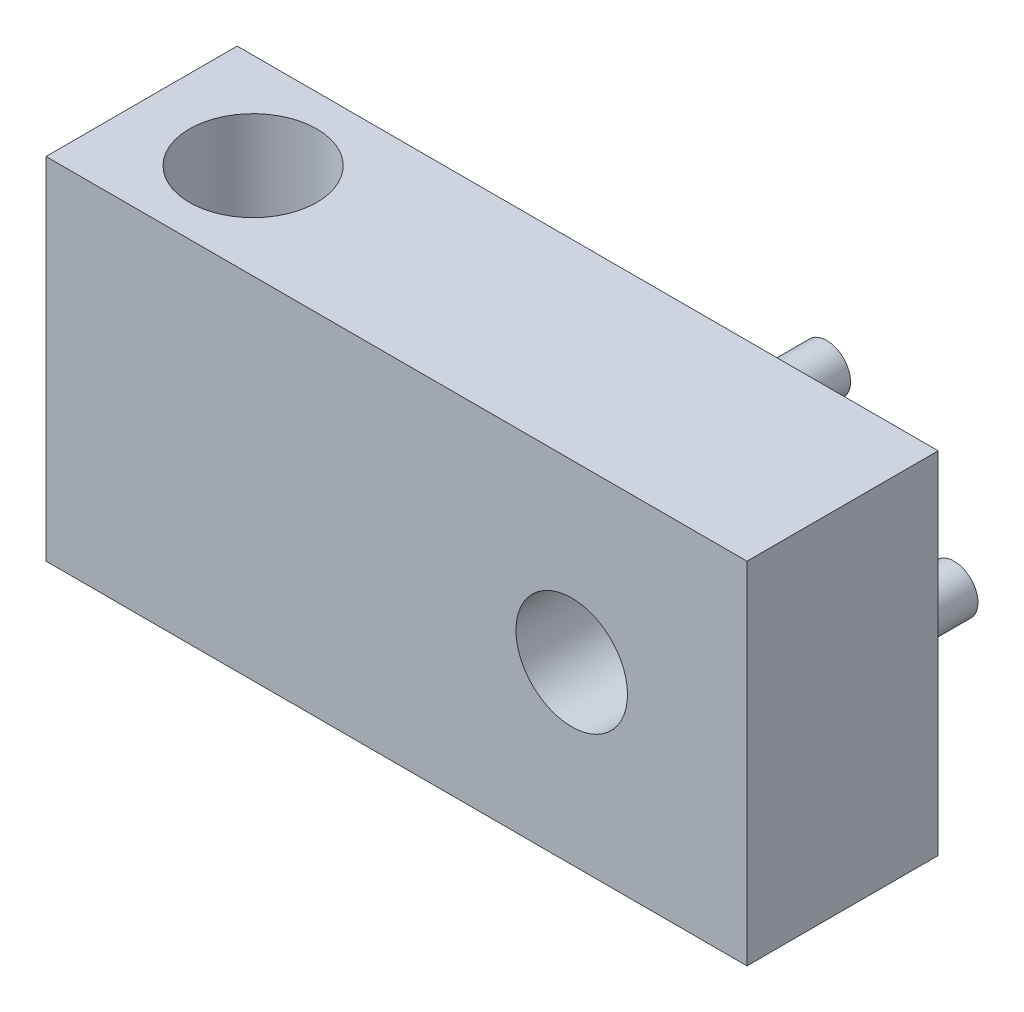
from build123d import *

# Parameters (mm, degrees)
SKETCH_1_W          = 22
SKETCH_1_H          = 22
EXTRUDE_1_DEPTH     = 12
SKETCH_3_R          = 3.5
CUT_EXTRUDE_2_DEPTH = 12
SKETCH_5_R          = 1.5
EXTRUDE_2_DEPTH     = 4
SKETCH_6_W          = 12
SKETCH_6_H          = 22
EXTRUDE_3_DEPTH     = 22
SKETCH_7_R          = 4
CUT_EXTRUDE_3_DEPTH = 22


with BuildPart() as part:
    # 草图1 → 凸台-拉伸1 (new body)
    with BuildSketch(Plane.XY):
        Rectangle(SKETCH_1_W, SKETCH_1_H)
    extrude(amount=EXTRUDE_1_DEPTH)

    # 草图3 → 切除-拉伸2 (cut)
    with BuildSketch(Plane.XY.offset(12)):
        Circle(SKETCH_3_R)
    extrude(amount=-CUT_EXTRUDE_2_DEPTH, mode=Mode.SUBTRACT)

    # 草图5 → 凸台-拉伸2 (add)
    with BuildSketch(Plane(origin=(0, 0, 0), x_dir=(-1, 0, 0), z_dir=(0, 0, -1))):
        with Locations(Location((0, 8, 0), (0, 0, 180))):
            Circle(SKETCH_5_R)
        with Locations(Location((8, 0, 0), (0, 0, 180))):
            Circle(SKETCH_5_R)
        with Locations(Location((0, -8, 0), (0, 0, 180))):
            Circle(SKETCH_5_R)
        with Locations(Location((-8, 0, 0), (0, 0, 180))):
            Circle(SKETCH_5_R)
    extrude(amount=EXTRUDE_2_DEPTH)

    # 草图6 → 凸台-拉伸3 (add)
    with BuildSketch(Plane.ZY.offset(11)):
        with Locations((6, 0)):
            Rectangle(SKETCH_6_W, SKETCH_6_H)
    extrude(amount=EXTRUDE_3_DEPTH)

    # 草图7 → 切除-拉伸3 (cut)
    with BuildSketch(Plane.XZ.offset(11)):
        with Locations(Location((-26, 6, 0), (0, 0, 270))):
            Circle(SKETCH_7_R)
    extrude(amount=-CUT_EXTRUDE_3_DEPTH, mode=Mode.SUBTRACT)


solid = part.part
